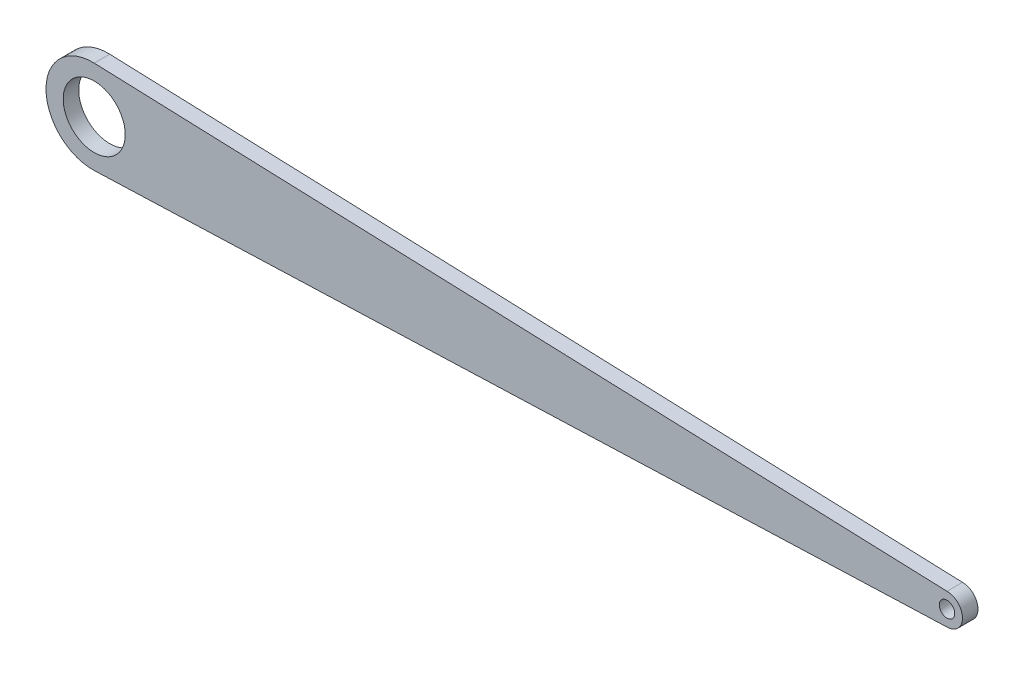
from build123d import *

# Parameters (mm, degrees)
ESBO_O1_R                = 10
ESBO_O1_R_2              = 2.5
RESSALTO_EXTRUS_O1_DEPTH = 5


with BuildPart() as part:
    # Esboço1 → Ressalto-extrusão1 (new body)
    with BuildSketch(Plane.XY):
        with BuildLine():
            Line((-137.5, -15), (137.5, -5))
            ThreePointArc((137.5, -5), (142.5, 0), (137.5, 5))
            Line((137.5, 5), (-137.5, 15))
            ThreePointArc((-137.5, 15), (-153.055368625, 0), (-137.5, -15))
        make_face()
        with Locations((-137.5, 0)):
            Circle(ESBO_O1_R, mode=Mode.SUBTRACT)
        with Locations((137.5, 0)):
            Circle(ESBO_O1_R_2, mode=Mode.SUBTRACT)
    extrude(amount=RESSALTO_EXTRUS_O1_DEPTH)


solid = part.part
